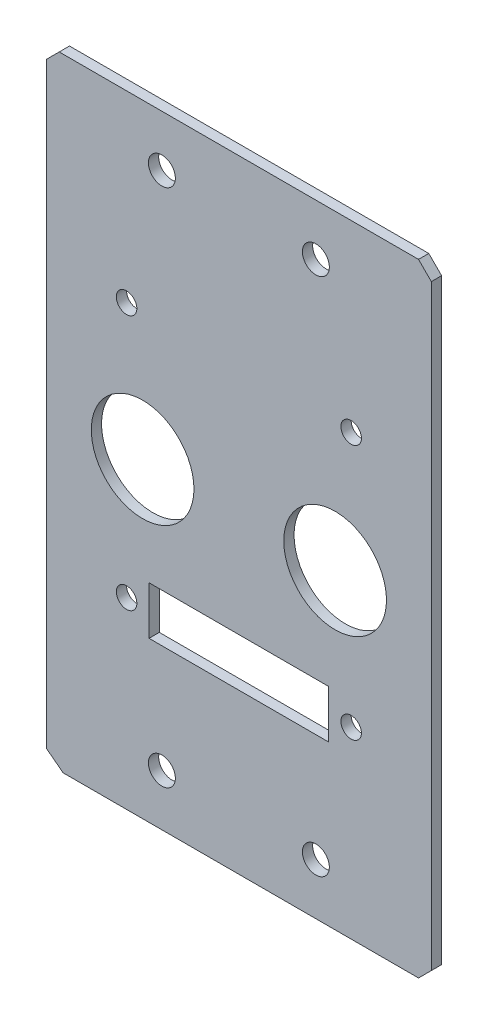
from build123d import *

# Parameters (mm, degrees)
SKETCH_1_R      = 8
SKETCH_1_R_2    = 1.6
SKETCH_1_R_3    = 2.1
SKETCH_1_W      = 28
SKETCH_1_H      = 7.5
EXTRUDE_1_DEPTH = 1.6


with BuildPart() as part:
    # 草图1 → 凸台-拉伸1 (new body)
    with BuildSketch(Plane.XY):
        Polygon((-28, 48.5), (28, 48.5), (30, 46.5), (30, -46.5), (28, -48.5), (-27.38960578, -48.5), (-30, -46.5), (-30, 46.5), align=None)
        with Locations((-15, 0)):
            Circle(SKETCH_1_R, mode=Mode.SUBTRACT)
        with Locations((-17.5, 19.9)):
            Circle(SKETCH_1_R_2, mode=Mode.SUBTRACT)
        with Locations((-12, 40.5)):
            Circle(SKETCH_1_R_3, mode=Mode.SUBTRACT)
        with Locations(Location((-17.5, -19.9, 0), (0, 0, 180))):
            Circle(SKETCH_1_R_2, mode=Mode.SUBTRACT)
        with Locations(Location((-12, -40.5, 0), (0, 0, 180))):
            Circle(SKETCH_1_R_3, mode=Mode.SUBTRACT)
        with Locations(Location((17.5, 19.9, 0), (0, 0, 180))):
            Circle(SKETCH_1_R_2, mode=Mode.SUBTRACT)
        with Locations(Location((12, 40.5, 0), (0, 0, 180))):
            Circle(SKETCH_1_R_3, mode=Mode.SUBTRACT)
        with Locations((12, -40.5)):
            Circle(SKETCH_1_R_3, mode=Mode.SUBTRACT)
        with Locations((17.5, -19.9)):
            Circle(SKETCH_1_R_2, mode=Mode.SUBTRACT)
        with Locations(Location((15, 0, 0), (0, 0, 180))):
            Circle(SKETCH_1_R, mode=Mode.SUBTRACT)
        with Locations((0, -19.9)):
            Rectangle(SKETCH_1_W, SKETCH_1_H, mode=Mode.SUBTRACT)
    extrude(amount=EXTRUDE_1_DEPTH)


solid = part.part
